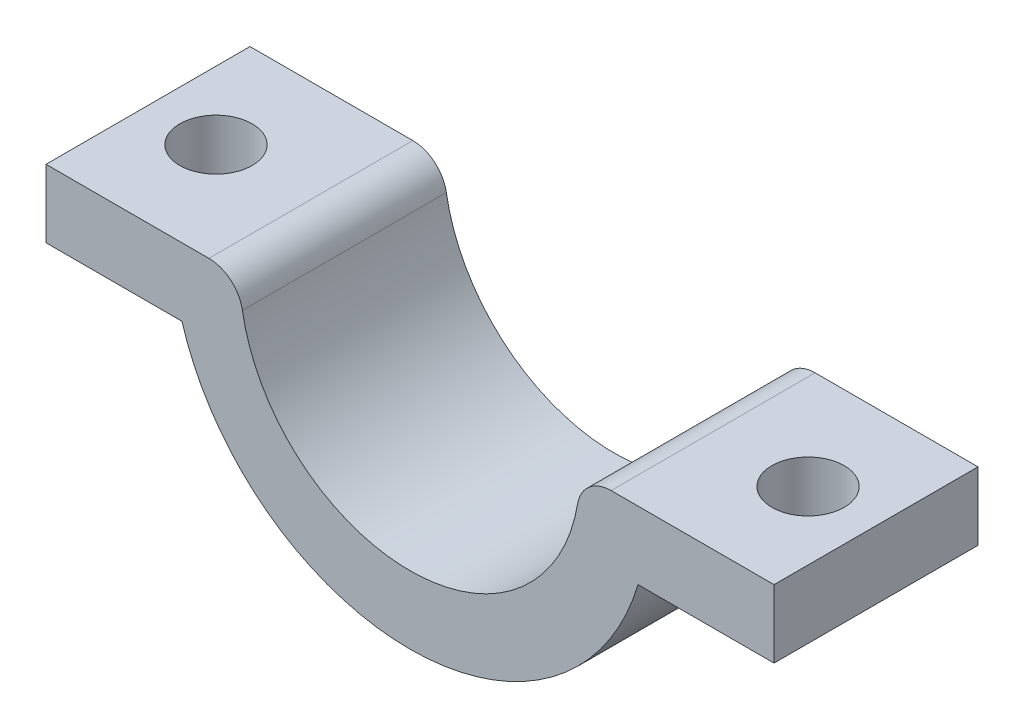
from build123d import *

# Parameters (mm, degrees)
BOSS_EXTRUDE1_DEPTH = 19.05
SKETCH2_R           = 3.3782
CUT_EXTRUDE1_DEPTH  = 43.081104502
FILLET1_R           = 3.175


with BuildPart() as part:
    # Sketch1 → Boss-Extrude1 (new body)
    with BuildSketch(Plane.XY):
        with BuildLine():
            Line((-15.875, 0), (-33.998547486, 0))
            Line((-33.998547486, 0), (-33.998547486, -6.35))
            Line((-33.998547486, -6.35), (-21.298547486, -6.35))
            ThreePointArc((-21.298547486, -6.35), (0, -22.225), (21.298547486, -6.35))
            Line((21.298547486, -6.35), (33.998547486, -6.35))
            Line((33.998547486, -6.35), (33.998547486, 0))
            Line((33.998547486, 0), (15.875, 0))
            ThreePointArc((15.875, 0), (0, -15.875), (-15.875, 0))
        make_face()
    extrude(amount=BOSS_EXTRUDE1_DEPTH)

    # Sketch2 → Cut-Extrude1 (cut, through all)
    with BuildSketch(Plane.XZ.offset(6.35)):
        with Locations(Location((27.648547486, 9.525, 0), (0, 0, 270))):
            Circle(SKETCH2_R)
        with Locations(Location((-27.648547486, 9.525, 0), (0, 0, 270))):
            Circle(SKETCH2_R)
    extrude(amount=-CUT_EXTRUDE1_DEPTH, mode=Mode.SUBTRACT)

    # Fillet1
    fillet1_edges = [part.edges().sort_by_distance(p)[0] for p in [
        (15.875, 0, 9.525),
        (-15.875, 0, 9.525),
    ]]
    fillet(fillet1_edges, radius=FILLET1_R)


solid = part.part
